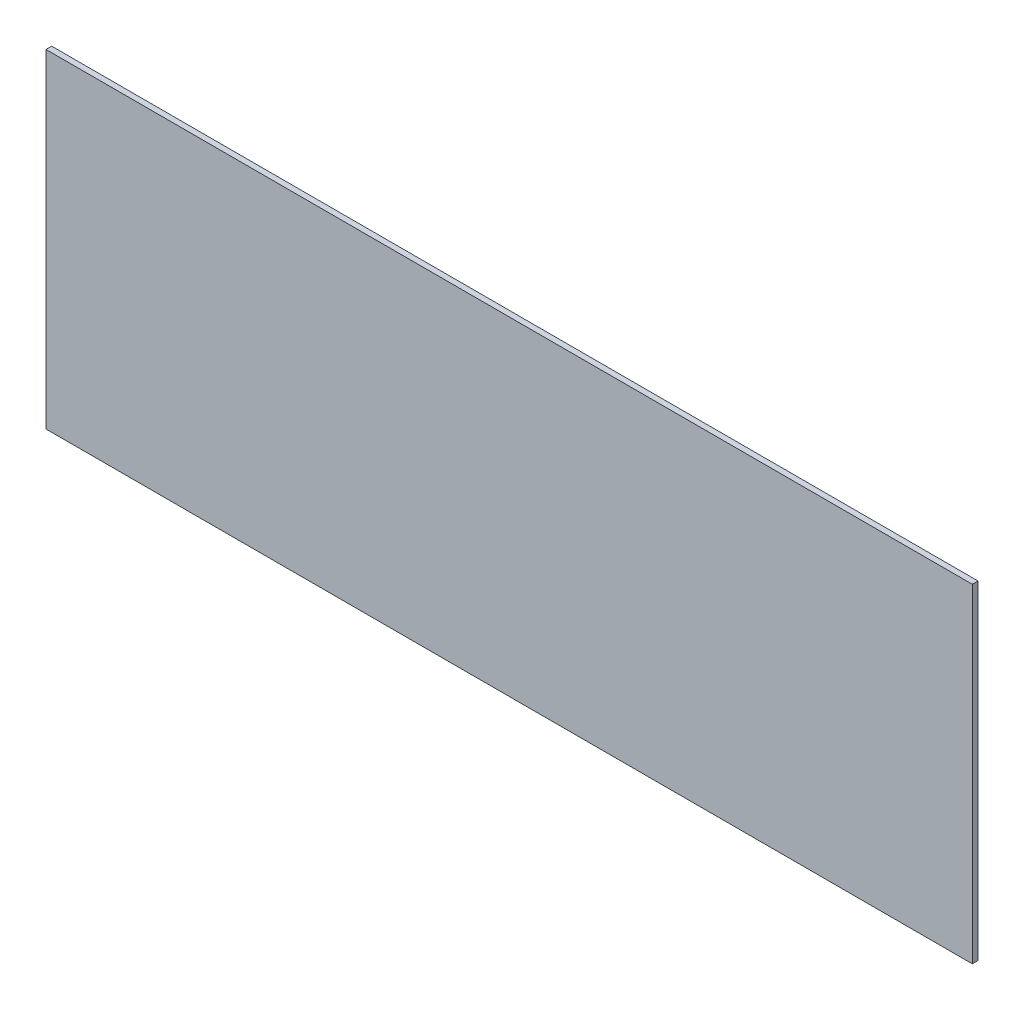
from build123d import *

# Parameters (mm, degrees)
SKETCH1_W           = 162.024
SKETCH1_H           = 57.5
BOSS_EXTRUDE1_DEPTH = 1


with BuildPart() as part:
    # Sketch1 → Boss-Extrude1 (new body)
    with BuildSketch(Plane.XY):
        with Locations((81.012, 28.75)):
            Rectangle(SKETCH1_W, SKETCH1_H)
    extrude(amount=BOSS_EXTRUDE1_DEPTH)


solid = part.part
